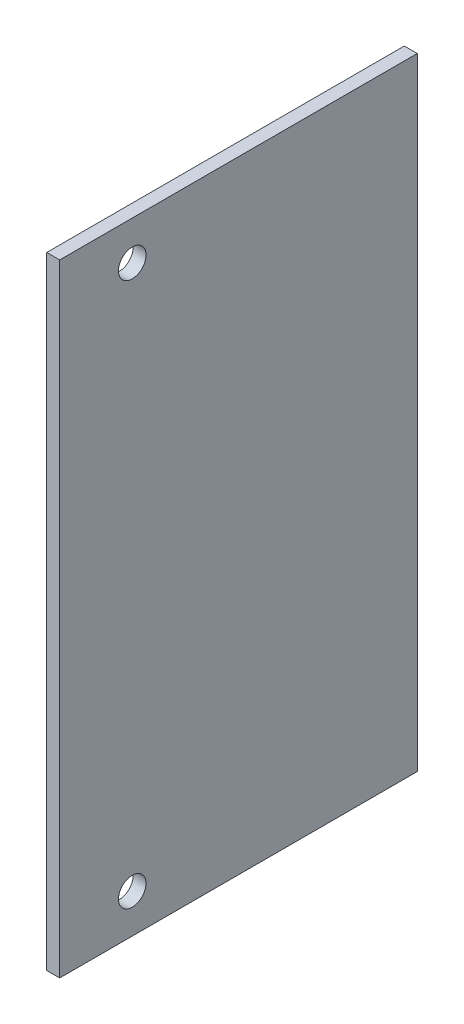
from build123d import *

# Parameters (mm, degrees)
SKETCH1_W               = 87.63
SKETCH1_H               = 152.4
BOSS_EXTRUDE1_DEPTH     = 3.175
F_1_4_CLEARANCE_HOLE1_D = 6.7564


with BuildPart() as part:
    # Sketch1 → Boss-Extrude1 (new body)
    with BuildSketch(Plane(origin=(0, 0, 0), x_dir=(0, 0, -1), z_dir=(1, 0, 0))):
        with Locations((43.815, 76.2)):
            Rectangle(SKETCH1_W, SKETCH1_H)
    extrude(amount=BOSS_EXTRUDE1_DEPTH)

    # 1/4 Clearance Hole1 (through all)
    with Locations(Plane(origin=(3.175, 0, 0), x_dir=(0, 0, -1), z_dir=(1, 0, 0))):
        with Locations((17.78, 142.875), (17.78, 9.525)):
            Hole(F_1_4_CLEARANCE_HOLE1_D / 2)


solid = part.part
